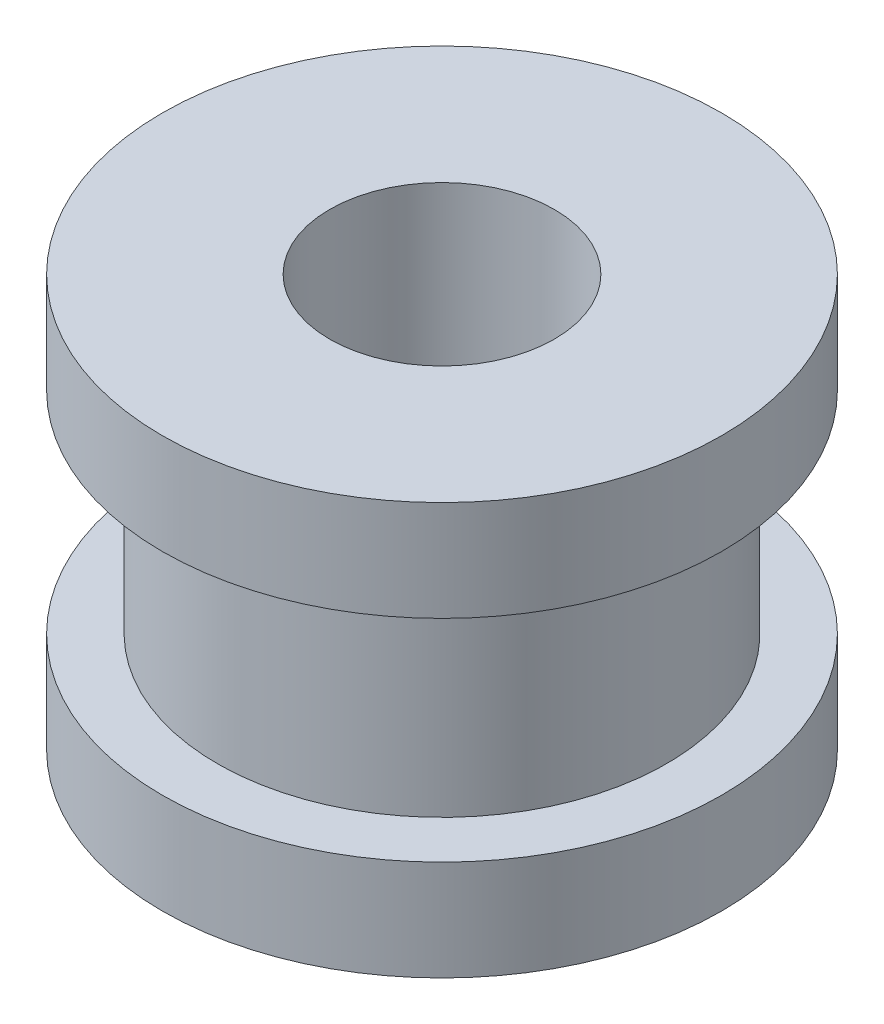
from build123d import *


with BuildPart() as part:
    # Esquisse1 → Révolution1 (revolve)
    with BuildSketch(Plane.XY):
        Polygon((0, 0), (-1, 0), (-1, 1.83), (0, 1.83), (0, 5.68), (-1, 5.68), (-1, 7.51), (2.05, 7.51), (2.05, 0), align=None)
    revolve(axis=Axis((4.1, 7.51, 0), (0, -1, 0)))


solid = part.part
